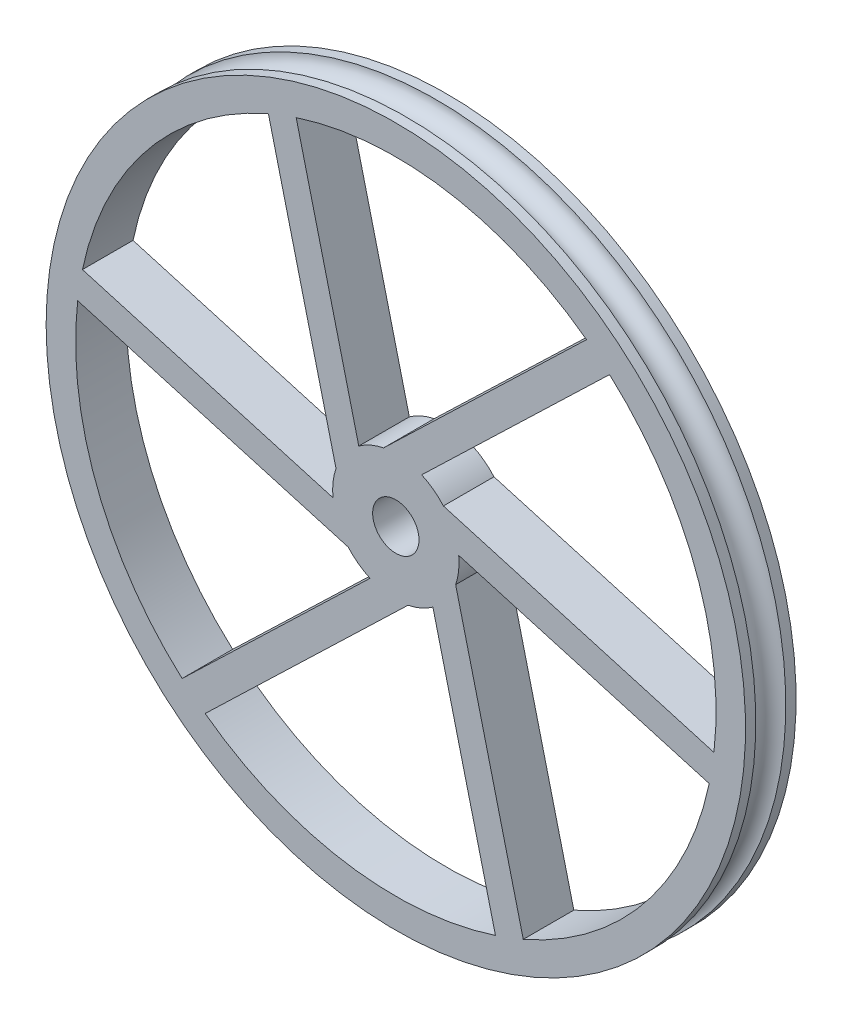
from build123d import *

# Parameters (mm, degrees)
CENTER_REACH             = 60.766
SKETCH3_R                = 7.5
CENTER_DIRECTION_2_REACH = 60.766
SPOKES_DEPTH             = 6
SKETCH5_R                = 2.75
HOLE_DEPTH               = 6


with BuildPart() as part:
    # Sketch2 → rim (revolve)
    with BuildSketch(Plane(origin=(0, 0, 0), x_dir=(1, 0, 0), z_dir=(0, 1, 0)), mode=Mode.PRIVATE) as rim_sk:
        with BuildLine():
            Line((41.5, -1.78), (41.5, -3))
            Line((41.5, -3), (38, -3))
            Line((38, -3), (38, 3))
            Line((38, 3), (41.5, 3))
            Line((41.5, 3), (41.5, 1.78))
            ThreePointArc((41.5, 1.78), (39.72, 0), (41.5, -1.78))
        make_face()
    revolve(rim_sk.sketch.rotate(Axis((0, 0, -19.925351406), (0, 0, 1)), 180), axis=Axis((0, 0, -19.925351406), (0, 0, 1)))


with BuildPart() as body_2:

    # center: up to this face of the body (flat: up to its plane)
    center_end = Plane(part.part.faces().sort_by_distance((40.326202743, 0, 3))[0])
    # Sketch3 → center (new, up to the picked face)
    with BuildSketch(Plane.XY, mode=Mode.PRIVATE) as center_sk1:
        with Locations(Location((0, 0, 0), (0, 0, 180))):
            Circle(SKETCH3_R)
    center_tool1 = split(extrude(center_sk1.sketch, amount=CENTER_REACH, mode=Mode.PRIVATE), bisect_by=center_end, keep=Keep.BOTH, mode=Mode.PRIVATE)
    add(center_tool1.solids().sort_by(Axis((0, 0, 0), (0, 0, 1)))[0])


    # center direction 2: up to this face of the body (flat: up to its plane)
    center_direction_2_end = Plane(part.part.faces().sort_by_distance((39.173797257, 0, -3))[0])
    # Sketch3 → center direction 2 (add, up to the picked face)
    with BuildSketch(Plane.XY, mode=Mode.PRIVATE) as center_direction_2_sk1:
        with Locations(Location((0, 0, 0), (0, 0, 180))):
            Circle(SKETCH3_R)
    center_direction_2_tool1 = split(extrude(center_direction_2_sk1.sketch, amount=-CENTER_DIRECTION_2_REACH, mode=Mode.PRIVATE), bisect_by=center_direction_2_end, keep=Keep.BOTH, mode=Mode.PRIVATE)
    add(center_direction_2_tool1.solids().sort_by(Axis((0, 0, 0), (0, 0, -1)))[0])


with BuildPart() as part_1:
    add(part.part)

    add(body_2.part)  # spokes merges body 2
    # Sketch4 → spokes (add)
    with BuildSketch(Plane.XY.offset(3)):
        Polygon((-1.454089233, 7.35769152), (23.049269408, 30.928550972), (25.47568141, 28.406146406), (3.06273149, 6.846143134), align=None)
        Polygon((5.644903153, 4.938123975), (38.309545548, -4.496977359), (37.338285116, -7.859514077), (7.460299618, 0.770668291), align=None)
        Polygon((7.098992386, -2.419567545), (15.26027614, -35.425528332), (11.862603706, -36.265660483), (4.397568127, -6.075474843), align=None)
        Polygon((1.454089233, -7.35769152), (-23.049269408, -30.928550972), (-25.47568141, -28.406146406), (-3.06273149, -6.846143134), align=None)
        Polygon((-5.644903153, -4.938123975), (-38.309545548, 4.496977359), (-37.338285116, 7.859514077), (-7.460299618, -0.770668291), align=None)
        Polygon((-7.098992386, 2.419567545), (-15.26027614, 35.425528332), (-11.862603706, 36.265660483), (-4.397568127, 6.075474843), align=None)
    extrude(amount=-SPOKES_DEPTH)

    # Sketch5 → hole (cut)
    with BuildSketch(Plane.XY.offset(3)):
        Circle(SKETCH5_R)
    extrude(amount=-HOLE_DEPTH, mode=Mode.SUBTRACT)


solid = part_1.part
